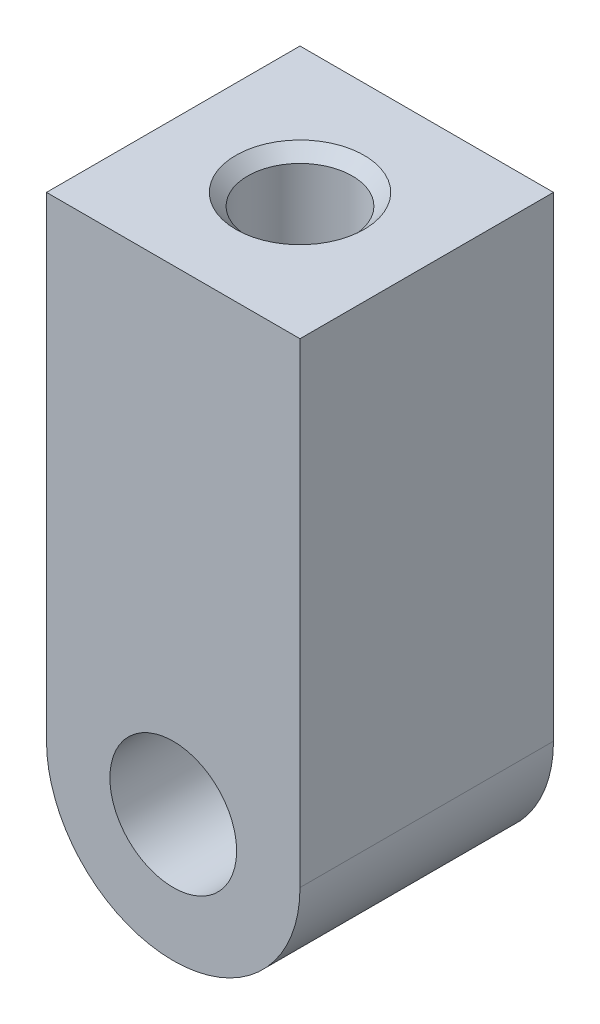
from build123d import *

# Parameters (mm, degrees)
SKETCH_1_R                  = 2
EXTRUDE_1_DEPTH             = 8
HOLE_WIZARD_M41_D           = 3.3
HOLE_WIZARD_M41_DEPTH       = 14.999
HOLE_WIZARD_M41_CSINK_D     = 4.05
HOLE_WIZARD_M41_CSINK_ANGLE = 90
HOLE_WIZARD_M41_TIP         = 0.991420021


with BuildPart() as part:
    # Эскиз1 → Бобышка-Вытянуть1 (new body)
    with BuildSketch(Plane.XY):
        with BuildLine():
            Line((-4, 15), (-4, 0))
            ThreePointArc((-4, 0), (0, -4), (4, 0))
            Line((4, 0), (4, 15))
            Line((4, 15), (-4, 15))
        make_face()
        Circle(SKETCH_1_R, mode=Mode.SUBTRACT)
    extrude(amount=EXTRUDE_1_DEPTH)

    # Отверстие обработанное метчиком M41
    with Locations(Plane(origin=(0, 15, 0), x_dir=(1, 0, 0), z_dir=(0, 1, 0))):
        with Locations((0, -4)):
            CounterSinkHole(HOLE_WIZARD_M41_D / 2, HOLE_WIZARD_M41_CSINK_D / 2, depth=HOLE_WIZARD_M41_DEPTH, counter_sink_angle=HOLE_WIZARD_M41_CSINK_ANGLE)
            with Locations((0, 0, -(HOLE_WIZARD_M41_DEPTH + HOLE_WIZARD_M41_TIP / 2))):  # 118° drill point
                Cone(0, HOLE_WIZARD_M41_D / 2, HOLE_WIZARD_M41_TIP, mode=Mode.SUBTRACT)


solid = part.part
